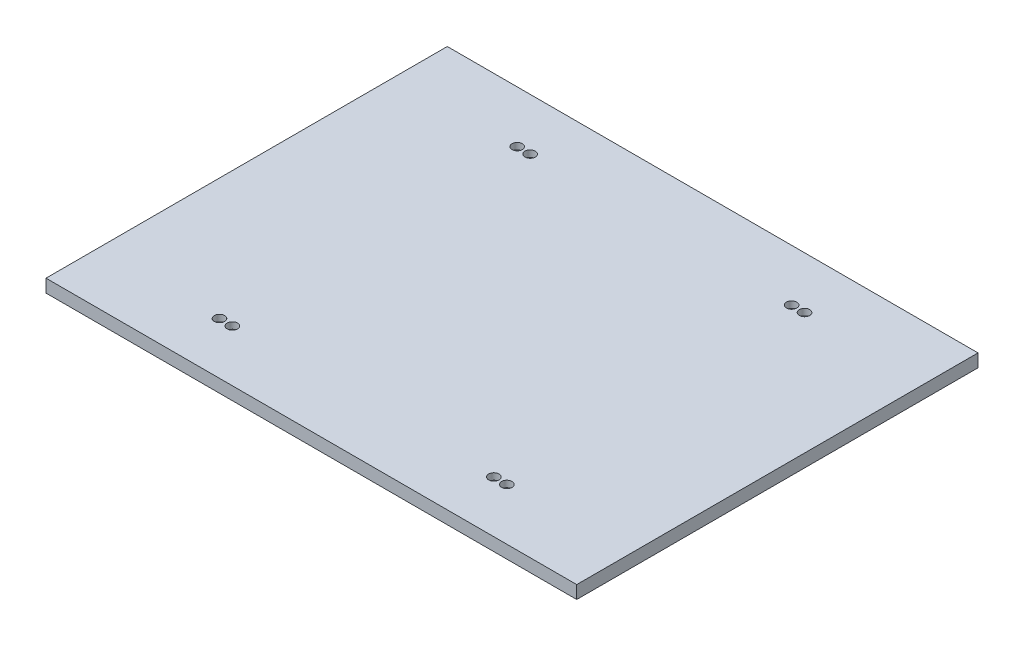
from build123d import *

# Parameters (mm, degrees)
SKETCH1_W           = 410
SKETCH1_H           = 310
BOSS_EXTRUDE1_DEPTH = 10
SKETCH2_R           = 2
CUT_EXTRUDE1_DEPTH  = 515.101157361
SKETCH3_R           = 4
CUT_EXTRUDE2_DEPTH  = 5


with BuildPart() as part:
    # Sketch1 → Boss-Extrude1 (new body)
    with BuildSketch(Plane(origin=(0, 0, 0), x_dir=(1, 0, 0), z_dir=(0, 1, 0))):
        with Locations((205, 155)):
            Rectangle(SKETCH1_W, SKETCH1_H)
    extrude(amount=BOSS_EXTRUDE1_DEPTH)

    # Sketch2 → Cut-Extrude1 (cut, through all)
    with BuildSketch(Plane(origin=(0, 10, 0), x_dir=(1, 0, 0), z_dir=(0, 1, 0))):
        with Locations(Location((94, 40, 0), (0, 0, 270))):
            Circle(SKETCH2_R)
        with Locations(Location((104, 40, 0), (0, 0, 270))):
            Circle(SKETCH2_R)
        with Locations(Location((306, 40, 0), (0, 0, 270))):
            Circle(SKETCH2_R)
        with Locations(Location((316, 40, 0), (0, 0, 270))):
            Circle(SKETCH2_R)
        with Locations(Location((316, 270, 0), (0, 0, 270))):
            Circle(SKETCH2_R)
        with Locations(Location((306, 270, 0), (0, 0, 270))):
            Circle(SKETCH2_R)
        with Locations(Location((104, 270, 0), (0, 0, 270))):
            Circle(SKETCH2_R)
        with Locations(Location((94, 270, 0), (0, 0, 270))):
            Circle(SKETCH2_R)
    extrude(amount=-CUT_EXTRUDE1_DEPTH, mode=Mode.SUBTRACT)

    # Sketch3 → Cut-Extrude2 (cut)
    with BuildSketch(Plane(origin=(0, 10, 0), x_dir=(1, 0, 0), z_dir=(0, 1, 0))):
        with Locations(Location((94, 270, 0), (0, 0, 270))):
            Circle(SKETCH3_R)
        with Locations(Location((104, 270, 0), (0, 0, 270))):
            Circle(SKETCH3_R)
        with Locations(Location((306, 270, 0), (0, 0, 270))):
            Circle(SKETCH3_R)
        with Locations(Location((316, 270, 0), (0, 0, 270))):
            Circle(SKETCH3_R)
        with Locations(Location((306, 40, 0), (0, 0, 270))):
            Circle(SKETCH3_R)
        with Locations(Location((316, 40, 0), (0, 0, 270))):
            Circle(SKETCH3_R)
        with Locations(Location((94, 40, 0), (0, 0, 270))):
            Circle(SKETCH3_R)
        with Locations(Location((104, 40, 0), (0, 0, 270))):
            Circle(SKETCH3_R)
    extrude(amount=-CUT_EXTRUDE2_DEPTH, mode=Mode.SUBTRACT)


solid = part.part
